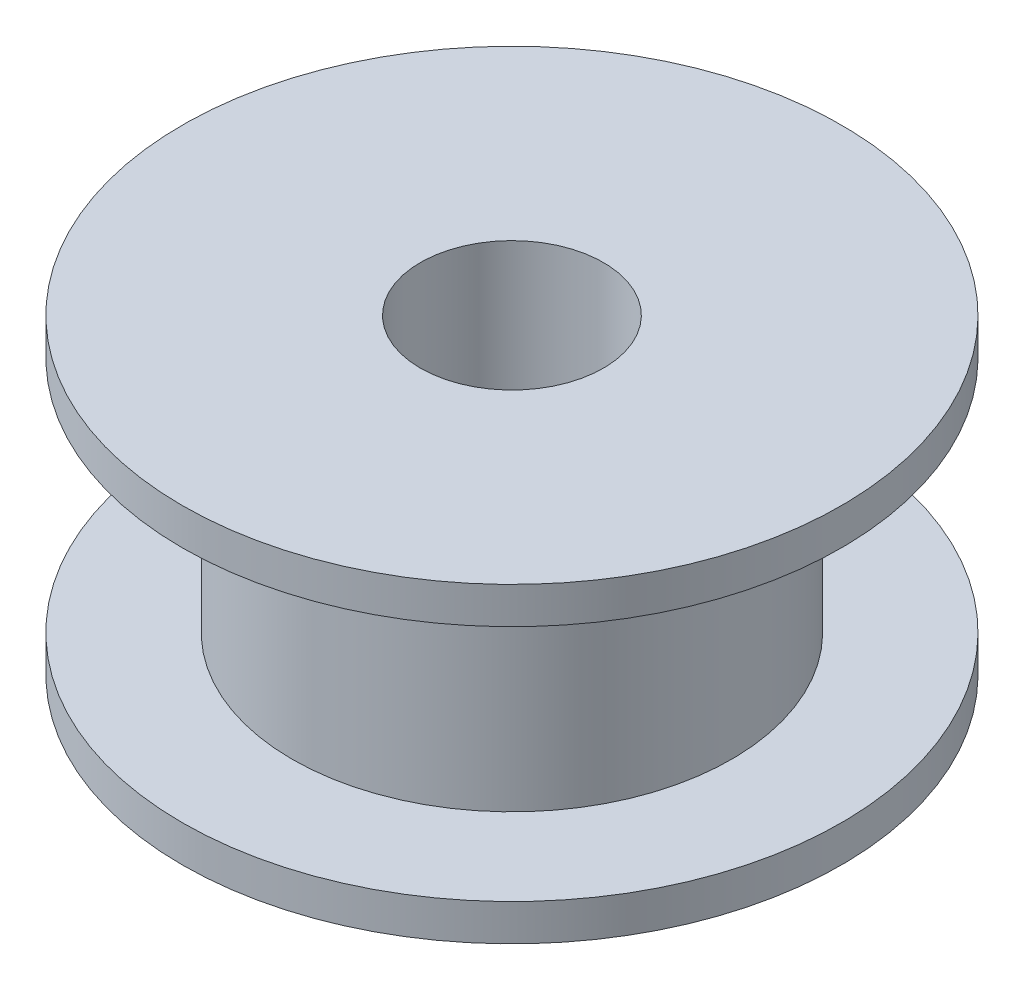
from build123d import *


with BuildPart() as part:
    # Sketch2 → Revolve1 (revolve)
    with BuildSketch(Plane.XY, mode=Mode.PRIVATE) as revolve1_sk:
        Polygon((2.5, -4.25), (2.5, 4.25), (9, 4.25), (9, 3.25), (6, 3.25), (6, -3.25), (9, -3.25), (9, -4.25), align=None)
    revolve(revolve1_sk.sketch.rotate(Axis((0, 55, 0), (0, -1, 0)), 90), axis=Axis((0, 55, 0), (0, -1, 0)))


solid = part.part
